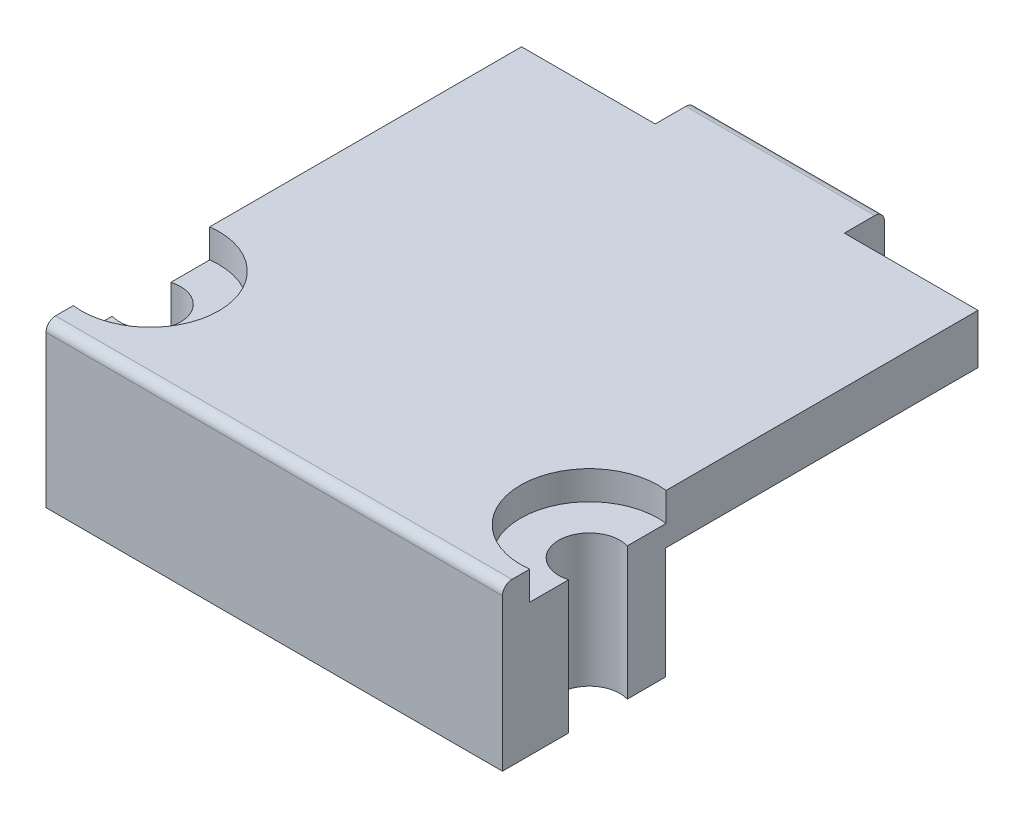
from build123d import *

# Parameters (mm, degrees)
BOSS_EXTRUDE1_DEPTH = 2.6
SKETCH2_W           = 23.9
SKETCH2_H           = 2
BOSS_EXTRUDE2_DEPTH = 5.85
CUT_EXTRUDE1_REACH  = 22.638
SKETCH3_R           = 1.6
BOSS_EXTRUDE3_DEPTH = 5.85
SKETCH5_W           = 1
SKETCH5_H           = 2.2
CUT_EXTRUDE2_DEPTH  = 2.1
SKETCH6_R           = 3.6
CUT_EXTRUDE3_DEPTH  = 1.5
FILLET1_R           = 0.5


with BuildPart() as part:
    # Sketch1 → Boss-Extrude1 (new body)
    with BuildSketch(Plane(origin=(0, 0, 0), x_dir=(1, 0, 0), z_dir=(0, 1, 0))):
        Polygon((-11.95, 12.45), (-11.95, -12.45), (11.95, -12.45), (11.95, 12.45), (4.95, 12.45), (4.95, 14.55), (-4.95, 14.55), (-4.95, 12.45), align=None)
    extrude(amount=BOSS_EXTRUDE1_DEPTH)

    # Sketch2 → Boss-Extrude2 (add)
    with BuildSketch(Plane.XZ):
        with Locations((0, 11.45)):
            Rectangle(SKETCH2_W, SKETCH2_H)
    extrude(amount=BOSS_EXTRUDE2_DEPTH)

    # Sketch3 → Cut-Extrude1 (cut, up to next)
    with BuildSketch(Plane(origin=(0, 2.6, 0), x_dir=(1, 0, 0), z_dir=(0, 1, 0)), mode=Mode.PRIVATE) as cut_extrude1_sk1:
        with Locations((-11.5, -7.45)):
            Circle(SKETCH3_R)
    cut_extrude1_tool1 = extrude(cut_extrude1_sk1.sketch, amount=-CUT_EXTRUDE1_REACH, mode=Mode.PRIVATE) & part.part
    # Sketch3 → Cut-Extrude1 (cut, up to next)
    with BuildSketch(Plane(origin=(0, 2.6, 0), x_dir=(1, 0, 0), z_dir=(0, 1, 0)), mode=Mode.PRIVATE) as cut_extrude1_sk2:
        with Locations((11.5, -7.45)):
            Circle(SKETCH3_R)
    cut_extrude1_tool2 = extrude(cut_extrude1_sk2.sketch, amount=-CUT_EXTRUDE1_REACH, mode=Mode.PRIVATE) & part.part
    add(cut_extrude1_tool1.solids().sort_by_distance((-11.5, 2.6, 7.45))[0], mode=Mode.SUBTRACT)
    add(cut_extrude1_tool2.solids().sort_by_distance((11.5, 2.6, 7.45))[0], mode=Mode.SUBTRACT)

    # Sketch4 → Boss-Extrude3 (add)
    with BuildSketch(Plane.XZ):
        with BuildLine():
            Line((-11.95, 5.914584747), (-11.95, 3.914584747))
            ThreePointArc((-11.95, 3.914584747), (-7.936061026, 7.45), (-11.95, 10.985415253))
            Line((-11.95, 10.985415253), (-11.95, 8.985415253))
            ThreePointArc((-11.95, 8.985415253), (-9.9, 7.45), (-11.95, 5.914584747))
        make_face()
        with BuildLine():
            Line((11.95, 10.985415253), (11.95, 8.985415253))
            ThreePointArc((11.95, 8.985415253), (9.9, 7.45), (11.95, 5.914584747))
            Line((11.95, 5.914584747), (11.95, 3.914584747))
            ThreePointArc((11.95, 3.914584747), (7.936061026, 7.45), (11.95, 10.985415253))
        make_face()
    extrude(amount=BOSS_EXTRUDE3_DEPTH)

    # Sketch5 → Cut-Extrude2 (cut)
    with BuildSketch(Plane.XZ.offset(5.85)):
        with Locations((-7.936061026, 7.45)):
            Rectangle(SKETCH5_W, SKETCH5_H)
    extrude(amount=-CUT_EXTRUDE2_DEPTH, mode=Mode.SUBTRACT)

    # Sketch6 → Cut-Extrude3 (cut)
    with BuildSketch(Plane(origin=(0, 2.6, 0), x_dir=(1, 0, 0), z_dir=(0, 1, 0))):
        with Locations((11.5, -7.45)):
            Circle(SKETCH6_R)
        with Locations((-11.5, -7.45)):
            Circle(SKETCH6_R)
    extrude(amount=-CUT_EXTRUDE3_DEPTH, mode=Mode.SUBTRACT)

    # Fillet1
    fillet1_edges = [part.edges().sort_by_distance(p)[0] for p in [
        (0, 2.6, 12.45),
        (0, 2.6, -14.55),
    ]]
    fillet(fillet1_edges, radius=FILLET1_R)


solid = part.part
